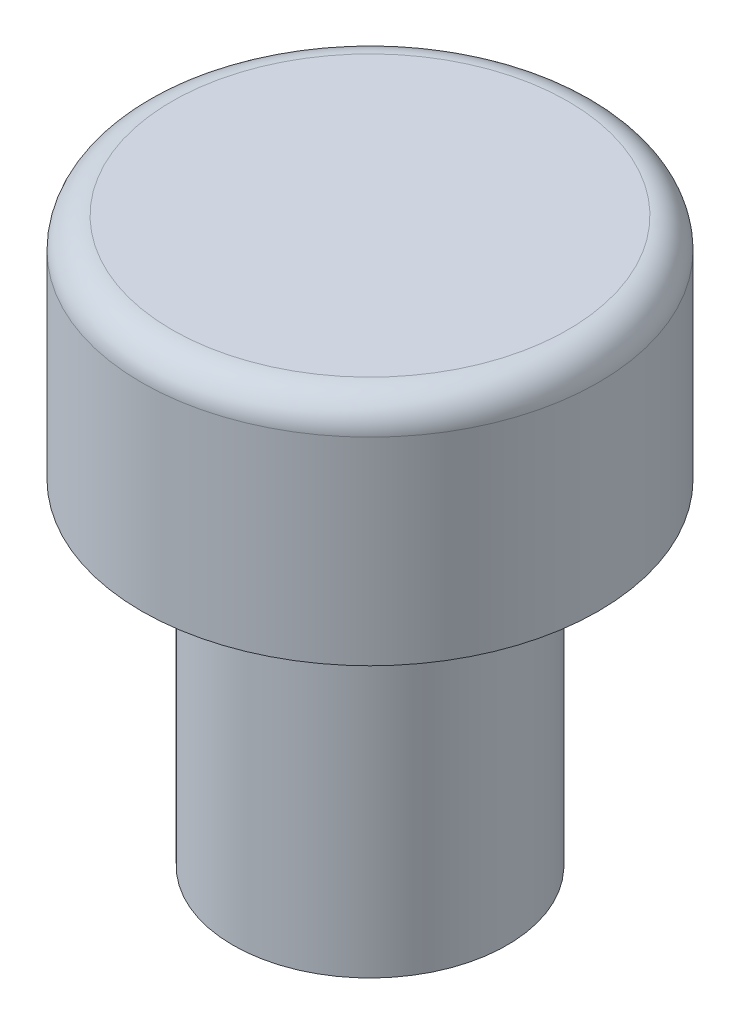
from build123d import *

# Parameters (mm, degrees)
SKETCH1_R           = 7.5
BOSS_EXTRUDE1_DEPTH = 7.5
FILLET1_R           = 1
SKETCH2_R           = 4.5
BOSS_EXTRUDE2_DEPTH = 11
SKETCH3_R           = 3.25
CUT_EXTRUDE1_DEPTH  = 11
BOSS_EXTRUDE3_START = 11
BOSS_EXTRUDE3_DEPTH = 11


with BuildPart() as part:
    # Sketch1 → Boss-Extrude1 (new body)
    with BuildSketch(Plane(origin=(0, 0, 0), x_dir=(1, 0, 0), z_dir=(0, 1, 0))):
        with Locations(Location((0, 0, 0), (0, 0, 270))):
            Circle(SKETCH1_R)
    extrude(amount=BOSS_EXTRUDE1_DEPTH)

    # Fillet1
    fillet1_edges = [part.edges().sort_by_distance(p)[0] for p in [
        (0, 7.5, -7.5),
    ]]
    fillet(fillet1_edges, radius=FILLET1_R)

    # Sketch2 → Boss-Extrude2 (add)
    with BuildSketch(Plane.XZ):
        with Locations(Location((0, 0, 0), (0, 0, 270))):
            Circle(SKETCH2_R)
    extrude(amount=BOSS_EXTRUDE2_DEPTH)

    # Sketch3 → Cut-Extrude1 (cut)
    with BuildSketch(Plane(origin=(0, -11, 0), x_dir=(-1, 0, 0), z_dir=(0, -1, 0))):
        with Locations(Location((0, 0, 0), (0, 0, 90))):
            Circle(SKETCH3_R)
    extrude(amount=-CUT_EXTRUDE1_DEPTH, mode=Mode.SUBTRACT)

    # Sketch4 → Boss-Extrude3 (add)
    with BuildSketch(Plane(origin=(0, 0, 0), x_dir=(-1, 0, 0), z_dir=(0, -1, 0)).offset(BOSS_EXTRUDE3_START)):
        with BuildLine():
            Line((1.75, 2.738612788), (1.75, -2.738612788))
            ThreePointArc((1.75, -2.738612788), (2.850438563, -1.5612495), (3.25, 0))
            ThreePointArc((3.25, 0), (2.850438563, 1.5612495), (1.75, 2.738612788))
        make_face()
    extrude(amount=-BOSS_EXTRUDE3_DEPTH)


solid = part.part
